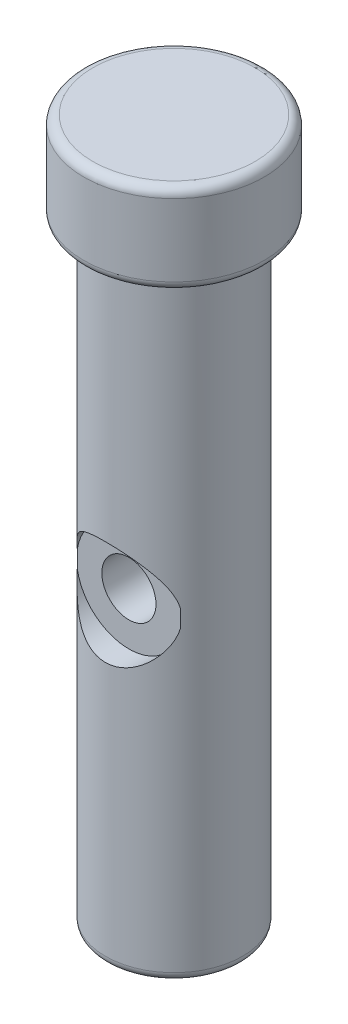
from build123d import *

# Parameters (mm, degrees)
VERRUNDUNG1_R                        = 0.5
SCHNITT_LINEAR_AUSTRAGEN1_DEPTH      = 40.635842378
SCHNITT_LINEAR_AUSTRAGEN1_DEPTH_BACK = 40.635842378
SKIZZE2_R                            = 1.5
SKIZZE3_R                            = 2.9
SCHNITT_LINEAR_AUSTRAGEN10_DEPTH     = 41.028115132


with BuildPart() as part:
    # Skizze1 → Rotation1 (revolve)
    with BuildSketch(Plane.XY):
        Polygon((0, 0), (0, -38), (-1.8, -38), (-1.8, -39), (-3.8, -39), (-3.8, -5), (-5, -5), (-5, 0), align=None)
    revolve(axis=Axis((0, 0, 0), (0, -1, 0)))

    # Verrundung1
    verrundung1_edges = [part.edges().sort_by_distance(p)[0] for p in [
        (5, 0, 0),
        (5, -5, 0),
        (3.8, -39, 0),
        (1.8, -39, 0),
    ]]
    fillet(verrundung1_edges, radius=VERRUNDUNG1_R)

    # Skizze2 → Schnitt-Linear austragen1 (cut, two sides: drawn at the far end of the back side and taken through both)
    with BuildSketch(Plane.XY.offset(-SCHNITT_LINEAR_AUSTRAGEN1_DEPTH_BACK)):
        with Locations((0, -21.5)):
            Circle(SKIZZE2_R)
    extrude(amount=SCHNITT_LINEAR_AUSTRAGEN1_DEPTH + SCHNITT_LINEAR_AUSTRAGEN1_DEPTH_BACK, mode=Mode.SUBTRACT)

    # Skizze3 → Schnitt-Linear austragen10 (cut, through all)
    with BuildSketch(Plane.XY.offset(2.5)):
        with Locations((0, -21.5)):
            Circle(SKIZZE3_R)
    extrude(amount=SCHNITT_LINEAR_AUSTRAGEN10_DEPTH, mode=Mode.SUBTRACT)


solid = part.part
